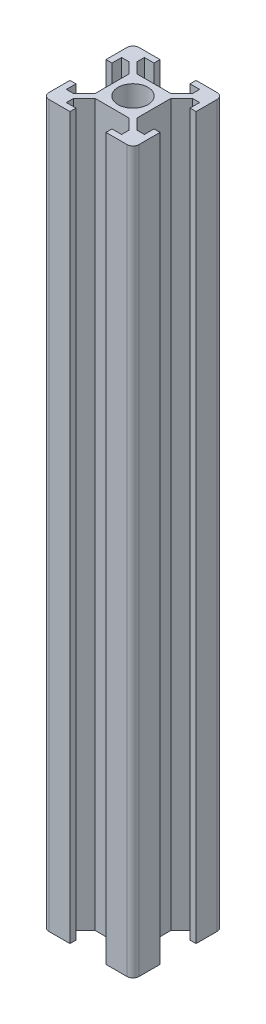
from build123d import *

# Parameters (mm, degrees)
BOSS_EXTRUDE1_DEPTH = 120


with BuildPart() as part:
    # Sketch1 → Boss-Extrude1 (new body)
    with BuildSketch(Plane(origin=(0, 0, 0), x_dir=(1, 0, 0), z_dir=(0, 1, 0))):
        with BuildLine():
            Line((-7.5, -3), (-7.5, -6.5))
            ThreePointArc((-7.5, -6.5), (-7.207106781, -7.207106781), (-6.5, -7.5))
            Line((-6.5, -7.5), (-3, -7.5))
            Line((-3, -7.5), (-3, -6.5))
            Line((-3, -6.5), (-4.6, -6.5))
            Line((-4.6, -6.5), (-4.6, -5.307106781))
            Line((-4.6, -5.307106781), (-2.8, -3.507106781))
            Line((-2.8, -3.507106781), (0, -3.507106781))
            Line((0, -3.507106781), (2.8, -3.507106781))
            Line((2.8, -3.507106781), (4.6, -5.307106781))
            Line((4.6, -5.307106781), (4.6, -6.5))
            Line((4.6, -6.5), (3, -6.5))
            Line((3, -6.5), (3, -7.5))
            Line((3, -7.5), (6.5, -7.5))
            ThreePointArc((6.5, -7.5), (7.207106781, -7.207106781), (7.5, -6.5))
            Line((7.5, -6.5), (7.5, -3))
            Line((7.5, -3), (6.5, -3))
            Line((6.5, -3), (6.5, -4.6))
            Line((6.5, -4.6), (5.307106781, -4.6))
            Line((5.307106781, -4.6), (3.507106781, -2.8))
            Line((3.507106781, -2.8), (3.507106781, 0))
            Line((3.507106781, 0), (3.507106781, 2.8))
            Line((3.507106781, 2.8), (5.307106781, 4.6))
            Line((5.307106781, 4.6), (6.5, 4.6))
            Line((6.5, 4.6), (6.5, 3))
            Line((6.5, 3), (7.5, 3))
            Line((7.5, 3), (7.5, 6.5))
            ThreePointArc((7.5, 6.5), (7.207106781, 7.207106781), (6.5, 7.5))
            Line((6.5, 7.5), (3, 7.5))
            Line((3, 7.5), (3, 6.5))
            Line((3, 6.5), (4.6, 6.5))
            Line((4.6, 6.5), (4.6, 5.307106781))
            Line((4.6, 5.307106781), (2.8, 3.507106781))
            Line((2.8, 3.507106781), (0, 3.507106781))
            Line((0, 3.507106781), (-2.8, 3.507106781))
            Line((-2.8, 3.507106781), (-4.6, 5.307106781))
            Line((-4.6, 5.307106781), (-4.6, 6.5))
            Line((-4.6, 6.5), (-3, 6.5))
            Line((-3, 6.5), (-3, 7.5))
            Line((-3, 7.5), (-6.5, 7.5))
            ThreePointArc((-6.5, 7.5), (-7.207106781, 7.207106781), (-7.5, 6.5))
            Line((-7.5, 6.5), (-7.5, 3))
            Line((-7.5, 3), (-6.5, 3))
            Line((-6.5, 3), (-6.5, 4.6))
            Line((-6.5, 4.6), (-5.307106781, 4.6))
            Line((-5.307106781, 4.6), (-3.507106781, 2.8))
            Line((-3.507106781, 2.8), (-3.507106781, 0))
            Line((-3.507106781, 0), (-3.507106781, -2.8))
            Line((-3.507106781, -2.8), (-5.307106781, -4.6))
            Line((-5.307106781, -4.6), (-6.5, -4.6))
            Line((-6.5, -4.6), (-6.5, -3))
            Line((-6.5, -3), (-7.5, -3))
        make_face()
        with BuildLine():
            ThreePointArc((-2.5, 0), (-1.767766953, -1.767766953), (0, -2.5))
            ThreePointArc((0, -2.5), (1.767766953, -1.767766953), (2.5, 0))
            ThreePointArc((2.5, 0), (1.767766953, 1.767766953), (0, 2.5))
            ThreePointArc((0, 2.5), (-1.767766953, 1.767766953), (-2.5, 0))
        make_face(mode=Mode.SUBTRACT)
    extrude(amount=BOSS_EXTRUDE1_DEPTH)


solid = part.part
